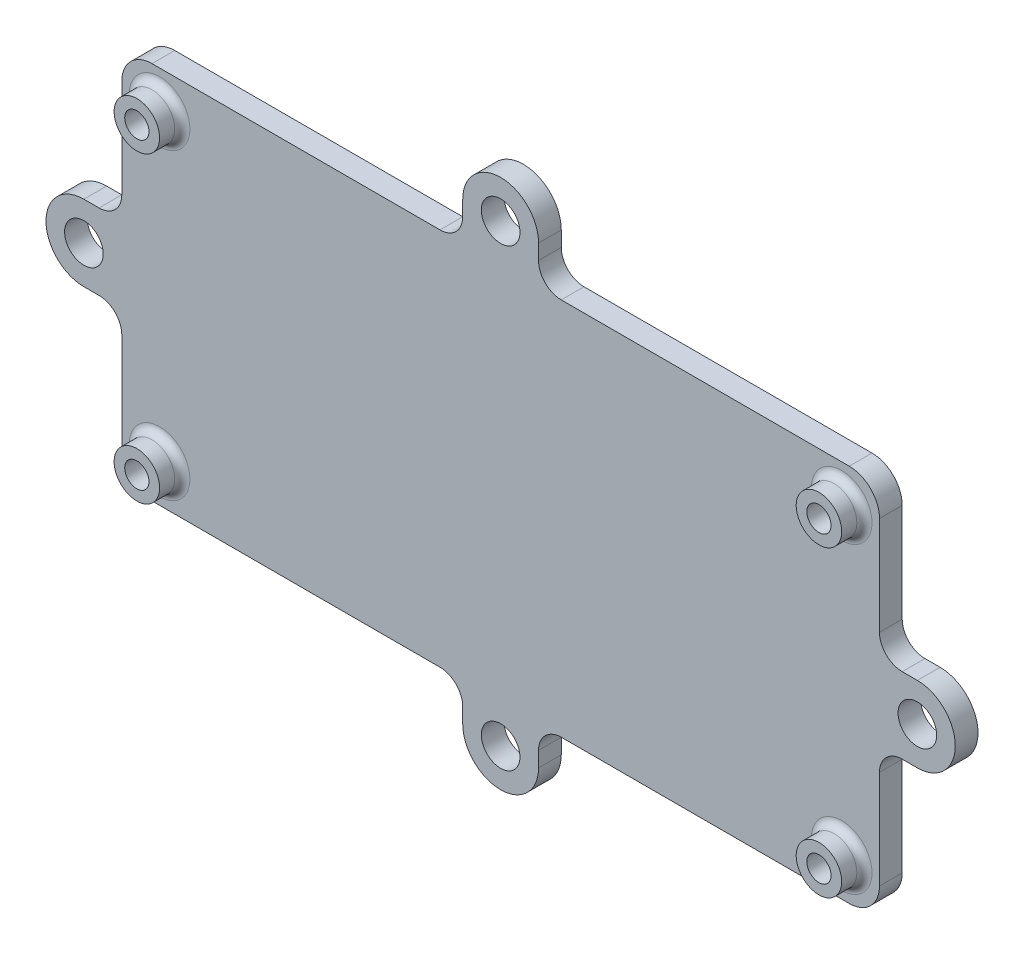
from build123d import *

# Parameters (mm, degrees)
SKETCH1_R           = 3
BOSS_EXTRUDE1_DEPTH = 3
SKETCH1_3_R         = 3
SKETCH1_3_R_2       = 1.600003175
BOSS_EXTRUDE2_DEPTH = 6
FILLET1_R           = 1
SKETCH2_R           = 2.55
BOSS_EXTRUDE3_DEPTH = 3
FILLET2_R           = 3


with BuildPart() as part:
    # Sketch1 → Boss-Extrude1 (new body)
    with BuildSketch(Plane.XY):
        with BuildLine():
            ThreePointArc((99.987500635, 4.00000762), (98.819645279, 1.180555381), (96.00019304, 0.012700025))
            Line((96.00019304, 0.012700025), (4.00000762, 0.012700025))
            ThreePointArc((4.00000762, 0.012700025), (1.180555381, 1.180555381), (0.012700025, 4.00000762))
            Line((0.012700025, 4.00000762), (0.012700025, 46.00009144))
            ThreePointArc((0.012700025, 46.00009144), (1.180555381, 48.819543679), (4.00000762, 49.987399035))
            Line((4.00000762, 49.987399035), (96.00019304, 49.987399035))
            ThreePointArc((96.00019304, 49.987399035), (98.819645279, 48.819543679), (99.987500635, 46.00009144))
            Line((99.987500635, 46.00009144), (99.987500635, 4.00000762))
        make_face()
        with Locations((95.0001905, 5.00001016)):
            Circle(SKETCH1_R, mode=Mode.SUBTRACT)
        with Locations((5.00001016, 5.00001016)):
            Circle(SKETCH1_R, mode=Mode.SUBTRACT)
        with Locations((95.0001905, 45.0000889)):
            Circle(SKETCH1_R, mode=Mode.SUBTRACT)
        with Locations((5.00001016, 45.0000889)):
            Circle(SKETCH1_R, mode=Mode.SUBTRACT)
    extrude(amount=BOSS_EXTRUDE1_DEPTH)

    # Sketch1<3> → Boss-Extrude2 (add)
    # profile 1 of 4: a face of its own
    with BuildSketch(Plane.XY):
        with Locations((5.00001016, 45.0000889)):
            Circle(SKETCH1_3_R)
        with Locations((5.00001016, 45.0000889)):
            Circle(SKETCH1_3_R_2, mode=Mode.SUBTRACT)
    # profile 2 of 4: a face of its own
    with BuildSketch(Plane.XY):
        with Locations((95.0001905, 45.0000889)):
            Circle(SKETCH1_3_R)
        with Locations((95.0001905, 45.0000889)):
            Circle(SKETCH1_3_R_2, mode=Mode.SUBTRACT)
    # profile 3 of 4: a face of its own
    with BuildSketch(Plane.XY):
        with Locations((95.0001905, 5.00001016)):
            Circle(SKETCH1_3_R)
        with Locations((95.0001905, 5.00001016)):
            Circle(SKETCH1_3_R_2, mode=Mode.SUBTRACT)
    # profile 4 of 4: a face of its own
    with BuildSketch(Plane.XY):
        with Locations((5.00001016, 5.00001016)):
            Circle(SKETCH1_3_R)
        with Locations((5.00001016, 5.00001016)):
            Circle(SKETCH1_3_R_2, mode=Mode.SUBTRACT)
    extrude(amount=BOSS_EXTRUDE2_DEPTH)

    # Fillet1
    fillet1_edges = [part.edges().sort_by_distance(p)[0] for p in [
        (92.0001905, 5.00001016, 3),
        (2.00001016, 5.00001016, 3),
        (92.0001905, 45.0000889, 3),
        (2.00001016, 45.0000889, 3),
    ]]
    fillet(fillet1_edges, radius=FILLET1_R)

    # Sketch2 → Boss-Extrude3 (add)
    # profile 1 of 4: a face of its own
    with BuildSketch(Plane.XY.offset(3)):
        with BuildLine():
            ThreePointArc((-4.987299975, 30.00004953), (-9.987299975, 25.00004953), (-4.987299975, 20.00004953))
            Line((-4.987299975, 20.00004953), (0.012700025, 20.00004953))
            Line((0.012700025, 20.00004953), (0.012700025, 25.00004953))
            Line((0.012700025, 25.00004953), (0.012700025, 30.00004953))
            Line((0.012700025, 30.00004953), (-4.987299975, 30.00004953))
        make_face()
        with Locations((-4.987299975, 25.00004953)):
            Circle(SKETCH2_R, mode=Mode.SUBTRACT)
    # profile 2 of 4: a face of its own
    with BuildSketch(Plane.XY.offset(3)):
        with BuildLine():
            Line((99.987500635, 30.00004953), (99.987500635, 25.00004953))
            Line((99.987500635, 25.00004953), (99.987500635, 20.00004953))
            Line((99.987500635, 20.00004953), (104.987500635, 20.00004953))
            ThreePointArc((104.987500635, 20.00004953), (109.987500635, 25.00004953), (104.987500635, 30.00004953))
            Line((104.987500635, 30.00004953), (99.987500635, 30.00004953))
        make_face()
        with Locations((104.987500635, 25.00004953)):
            Circle(SKETCH2_R, mode=Mode.SUBTRACT)
    # profile 3 of 4: a face of its own
    with BuildSketch(Plane.XY.offset(3)):
        with BuildLine():
            Line((45.00010033, 49.987399035), (50.00010033, 49.987399035))
            Line((50.00010033, 49.987399035), (55.00010033, 49.987399035))
            Line((55.00010033, 49.987399035), (55.00010033, 54.987399035))
            ThreePointArc((55.00010033, 54.987399035), (50.00010033, 59.987399035), (45.00010033, 54.987399035))
            Line((45.00010033, 54.987399035), (45.00010033, 49.987399035))
        make_face()
        with Locations((50.00010033, 54.987399035)):
            Circle(SKETCH2_R, mode=Mode.SUBTRACT)
    # profile 4 of 4: a face of its own
    with BuildSketch(Plane.XY.offset(3)):
        with BuildLine():
            Line((55.00010033, 0.012700025), (50.00010033, 0.012700025))
            Line((50.00010033, 0.012700025), (45.00010033, 0.012700025))
            Line((45.00010033, 0.012700025), (45.00010033, -4.987299975))
            ThreePointArc((45.00010033, -4.987299975), (50.00010033, -9.987299975), (55.00010033, -4.987299975))
            Line((55.00010033, -4.987299975), (55.00010033, 0.012700025))
        make_face()
        with Locations((50.00010033, -4.987299975)):
            Circle(SKETCH2_R, mode=Mode.SUBTRACT)
    extrude(amount=-BOSS_EXTRUDE3_DEPTH)

    # Fillet2
    fillet2_edges = [part.edges().sort_by_distance(p)[0] for p in [
        (99.987500635, 30.00004953, 1.5),
        (99.987500635, 20.00004953, 1.5),
        (55.00010033, 0.012700025, 1.5),
        (45.00010033, 0.012700025, 1.5),
        (0.012700025, 20.00004953, 1.5),
        (0.012700025, 30.00004953, 1.5),
        (55.00010033, 49.987399035, 1.5),
        (45.00010033, 49.987399035, 1.5),
    ]]
    fillet(fillet2_edges, radius=FILLET2_R)


solid = part.part
